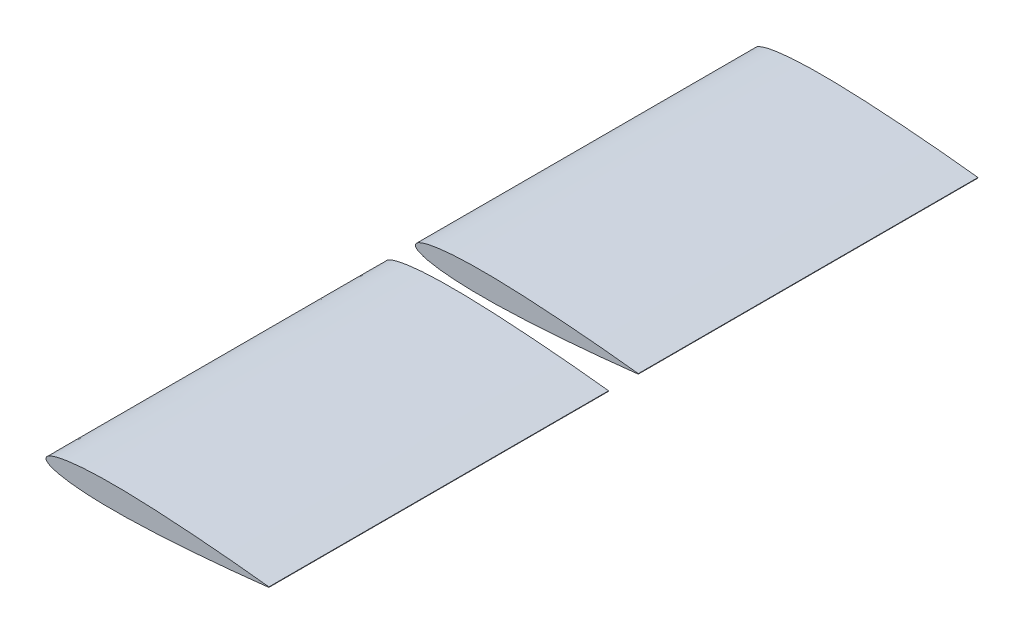
from build123d import *


with BuildPart() as part:
    # Sketch 1 → По сечениям4 section 0
    with BuildSketch(Plane.XY.offset(14)):
        with BuildLine():
            Line((210, 0.2205), (210, -0.2205))
            add(Edge.make_bspline(
                [(0, 0), (0.034067158, -0.292420603), (0.105664858, -0.906990272), (0.654982145, -1.762850878), (1.477827244, -2.567627053), (2.606267905, -3.33690789), (4.023091511, -4.075617294), (5.729219654, -4.784368811), (7.717704809, -5.461720006), (9.98279734, -6.105524733), (12.517370375, -6.713573353), (15.314137556, -7.283443053), (18.365421313, -7.812822801), (21.663304874, -8.299509245), (25.1996562, -8.741465325), (28.966118871, -9.136828938), (32.954113391, -9.484099728), (37.154859686, -9.781897518), (41.559328957, -10.029322752), (46.158276606, -10.225747383), (50.942192731, -10.37091927), (55.901307934, -10.464829704), (61.025559499, -10.508057783), (66.304593914, -10.501238629), (71.727718495, -10.445589818), (77.283891512, -10.342483403), (82.961677867, -10.193594784), (88.749245035, -10.000889903), (94.634276627, -9.76650495), (100.603972997, -9.49274666), (106.644960348, -9.182071299), (112.74327925, -8.837080271), (118.884264816, -8.460372529), (125.052501733, -8.054703608), (131.231690824, -7.622832713), (137.404553341, -7.167478469), (143.552678434, -6.69153668), (149.656348433, -6.197904303), (155.694280367, -5.68953216), (161.643397975, -5.169597978), (169.323110232, -4.474488912), (176.790491196, -3.765014701), (184.000325759, -3.047702994), (189.058977114, -2.529705217), (193.816398006, -2.02910314), (198.210146873, -1.554729941), (202.157323921, -1.118317034), (205.534938991, -0.736774478), (208.088501201, -0.443419152), (209.496053987, -0.279270227), (210, -0.2205)],
                knots=[0, 0, 0, 0, 0.004099011, 0.008614742, 0.013934855, 0.020277775, 0.027752981, 0.036410215, 0.046266433, 0.057320238, 0.069558946, 0.082962861, 0.097507218, 0.113164082, 0.12990269, 0.147690304, 0.166492185, 0.186271967, 0.206991861, 0.228612215, 0.251092165, 0.274388983, 0.298458209, 0.323253842, 0.348727971, 0.374830387, 0.40150919, 0.428710016, 0.456376154, 0.484448083, 0.512863887, 0.541558094, 0.570462313, 0.599504248, 0.628607349, 0.657690446, 0.686667237, 0.715444849, 0.743923546, 0.77199483, 0.799540253, 0.852512115, 0.877624446, 0.901571134, 0.924121062, 0.944988816, 0.963803939, 0.980044339, 0.992855276, 1, 1, 1, 1], degree=3))
            add(Edge.make_bspline(
                [(210, 0.2205), (209.496053987, 0.279270227), (208.088501201, 0.443419152), (205.534938991, 0.736774478), (202.157323921, 1.118317034), (198.210146873, 1.554729941), (193.816398006, 2.02910314), (189.058977114, 2.529705217), (184.000325759, 3.047702994), (176.790491196, 3.765014701), (169.323110232, 4.474488912), (161.643397975, 5.169597978), (155.694280367, 5.68953216), (149.656348433, 6.197904303), (143.552678434, 6.69153668), (137.404553341, 7.167478469), (131.231690824, 7.622832713), (125.052501733, 8.054703608), (118.884264816, 8.460372529), (112.74327925, 8.837080271), (106.644960348, 9.182071299), (100.603972997, 9.49274666), (94.634276627, 9.76650495), (88.749245035, 10.000889903), (82.961677867, 10.193594784), (77.283891512, 10.342483403), (71.727718495, 10.445589818), (66.304593914, 10.501238629), (61.025559499, 10.508057783), (55.901307934, 10.464829704), (50.942192731, 10.37091927), (46.158276606, 10.225747383), (41.559328957, 10.029322752), (37.154859686, 9.781897518), (32.954113391, 9.484099728), (28.966118871, 9.136828938), (25.1996562, 8.741465325), (21.663304874, 8.299509245), (18.365421313, 7.812822801), (15.314137556, 7.283443053), (12.517370375, 6.713573353), (9.98279734, 6.105524733), (7.717704809, 5.461720006), (5.729219654, 4.784368811), (4.023091511, 4.075617294), (2.606267905, 3.33690789), (1.477827244, 2.567627053), (0.654982145, 1.762850878), (0.105664858, 0.906990272), (0.034067158, 0.292420603), (0, 0)],
                knots=[0, 0, 0, 0, 0.007144724, 0.019955661, 0.036196061, 0.055011184, 0.075878938, 0.098428866, 0.122375554, 0.147487885, 0.200459747, 0.22800517, 0.256076454, 0.284555151, 0.313332763, 0.342309554, 0.371392651, 0.400495752, 0.429537687, 0.458441906, 0.487136113, 0.515551917, 0.543623846, 0.571289984, 0.59849081, 0.625169613, 0.651272029, 0.676746158, 0.701541791, 0.725611017, 0.748907835, 0.771387785, 0.793008139, 0.813728033, 0.833507815, 0.852309696, 0.87009731, 0.886835918, 0.902492782, 0.917037139, 0.930441054, 0.942679762, 0.953733567, 0.963589785, 0.972247019, 0.979722225, 0.986065145, 0.991385258, 0.995900989, 1, 1, 1, 1], degree=3))
        make_face()
    # Sketch 2 → По сечениям4 section 1
    with BuildSketch(Plane.XY.offset(170)):
        with BuildLine():
            Line((210, 0.2205), (210, -0.2205))
            add(Edge.make_bspline(
                [(0, 0), (0.034067158, -0.292420603), (0.105664858, -0.906990272), (0.654982145, -1.762850878), (1.477827244, -2.567627053), (2.606267905, -3.33690789), (4.023091511, -4.075617294), (5.729219654, -4.784368811), (7.717704809, -5.461720006), (9.98279734, -6.105524733), (12.517370375, -6.713573353), (15.314137556, -7.283443053), (18.365421313, -7.812822801), (21.663304874, -8.299509245), (25.1996562, -8.741465325), (28.966118871, -9.136828938), (32.954113391, -9.484099728), (37.154859686, -9.781897518), (41.559328957, -10.029322752), (46.158276606, -10.225747383), (50.942192731, -10.37091927), (55.901307934, -10.464829704), (61.025559499, -10.508057783), (66.304593914, -10.501238629), (71.727718495, -10.445589818), (77.283891512, -10.342483403), (82.961677867, -10.193594784), (88.749245035, -10.000889903), (94.634276627, -9.76650495), (100.603972997, -9.49274666), (106.644960348, -9.182071299), (112.74327925, -8.837080271), (118.884264816, -8.460372529), (125.052501733, -8.054703608), (131.231690824, -7.622832713), (137.404553341, -7.167478469), (143.552678434, -6.69153668), (149.656348433, -6.197904303), (155.694280367, -5.68953216), (161.643397975, -5.169597978), (169.323110232, -4.474488912), (176.790491196, -3.765014701), (184.000325759, -3.047702994), (189.058977114, -2.529705217), (193.816398006, -2.02910314), (198.210146873, -1.554729941), (202.157323921, -1.118317034), (205.534938991, -0.736774478), (208.088501201, -0.443419152), (209.496053987, -0.279270227), (210, -0.2205)],
                knots=[0, 0, 0, 0, 0.004099011, 0.008614742, 0.013934855, 0.020277775, 0.027752981, 0.036410215, 0.046266433, 0.057320238, 0.069558946, 0.082962861, 0.097507218, 0.113164082, 0.12990269, 0.147690304, 0.166492185, 0.186271967, 0.206991861, 0.228612215, 0.251092165, 0.274388983, 0.298458209, 0.323253842, 0.348727971, 0.374830387, 0.40150919, 0.428710016, 0.456376154, 0.484448083, 0.512863887, 0.541558094, 0.570462313, 0.599504248, 0.628607349, 0.657690446, 0.686667237, 0.715444849, 0.743923546, 0.77199483, 0.799540253, 0.852512115, 0.877624446, 0.901571134, 0.924121062, 0.944988816, 0.963803939, 0.980044339, 0.992855276, 1, 1, 1, 1], degree=3))
            add(Edge.make_bspline(
                [(210, 0.2205), (209.496053987, 0.279270227), (208.088501201, 0.443419152), (205.534938991, 0.736774478), (202.157323921, 1.118317034), (198.210146873, 1.554729941), (193.816398006, 2.02910314), (189.058977114, 2.529705217), (184.000325759, 3.047702994), (176.790491196, 3.765014701), (169.323110232, 4.474488912), (161.643397975, 5.169597978), (155.694280367, 5.68953216), (149.656348433, 6.197904303), (143.552678434, 6.69153668), (137.404553341, 7.167478469), (131.231690824, 7.622832713), (125.052501733, 8.054703608), (118.884264816, 8.460372529), (112.74327925, 8.837080271), (106.644960348, 9.182071299), (100.603972997, 9.49274666), (94.634276627, 9.76650495), (88.749245035, 10.000889903), (82.961677867, 10.193594784), (77.283891512, 10.342483403), (71.727718495, 10.445589818), (66.304593914, 10.501238629), (61.025559499, 10.508057783), (55.901307934, 10.464829704), (50.942192731, 10.37091927), (46.158276606, 10.225747383), (41.559328957, 10.029322752), (37.154859686, 9.781897518), (32.954113391, 9.484099728), (28.966118871, 9.136828938), (25.1996562, 8.741465325), (21.663304874, 8.299509245), (18.365421313, 7.812822801), (15.314137556, 7.283443053), (12.517370375, 6.713573353), (9.98279734, 6.105524733), (7.717704809, 5.461720006), (5.729219654, 4.784368811), (4.023091511, 4.075617294), (2.606267905, 3.33690789), (1.477827244, 2.567627053), (0.654982145, 1.762850878), (0.105664858, 0.906990272), (0.034067158, 0.292420603), (0, 0)],
                knots=[0, 0, 0, 0, 0.007144724, 0.019955661, 0.036196061, 0.055011184, 0.075878938, 0.098428866, 0.122375554, 0.147487885, 0.200459747, 0.22800517, 0.256076454, 0.284555151, 0.313332763, 0.342309554, 0.371392651, 0.400495752, 0.429537687, 0.458441906, 0.487136113, 0.515551917, 0.543623846, 0.571289984, 0.59849081, 0.625169613, 0.651272029, 0.676746158, 0.701541791, 0.725611017, 0.748907835, 0.771387785, 0.793008139, 0.813728033, 0.833507815, 0.852309696, 0.87009731, 0.886835918, 0.902492782, 0.917037139, 0.930441054, 0.942679762, 0.953733567, 0.963589785, 0.972247019, 0.979722225, 0.986065145, 0.991385258, 0.995900989, 1, 1, 1, 1], degree=3))
        make_face()
    # Sketch 3 → По сечениям4 section 2
    with BuildSketch(Plane.XY.offset(334)):
        with BuildLine():
            Line((210, 0.2205), (210, -0.2205))
            add(Edge.make_bspline(
                [(0, 0), (0.034067158, -0.292420603), (0.105664858, -0.906990272), (0.654982145, -1.762850878), (1.477827244, -2.567627053), (2.606267905, -3.33690789), (4.023091511, -4.075617294), (5.729219654, -4.784368811), (7.717704809, -5.461720006), (9.98279734, -6.105524733), (12.517370375, -6.713573353), (15.314137556, -7.283443053), (18.365421313, -7.812822801), (21.663304874, -8.299509245), (25.1996562, -8.741465325), (28.966118871, -9.136828938), (32.954113391, -9.484099728), (37.154859686, -9.781897518), (41.559328957, -10.029322752), (46.158276606, -10.225747383), (50.942192731, -10.37091927), (55.901307934, -10.464829704), (61.025559499, -10.508057783), (66.304593914, -10.501238629), (71.727718495, -10.445589818), (77.283891512, -10.342483403), (82.961677867, -10.193594784), (88.749245035, -10.000889903), (94.634276627, -9.76650495), (100.603972997, -9.49274666), (106.644960348, -9.182071299), (112.74327925, -8.837080271), (118.884264816, -8.460372529), (125.052501733, -8.054703608), (131.231690824, -7.622832713), (137.404553341, -7.167478469), (143.552678434, -6.69153668), (149.656348433, -6.197904303), (155.694280367, -5.68953216), (161.643397975, -5.169597978), (169.323110232, -4.474488912), (176.790491196, -3.765014701), (184.000325759, -3.047702994), (189.058977114, -2.529705217), (193.816398006, -2.02910314), (198.210146873, -1.554729941), (202.157323921, -1.118317034), (205.534938991, -0.736774478), (208.088501201, -0.443419152), (209.496053987, -0.279270227), (210, -0.2205)],
                knots=[0, 0, 0, 0, 0.004099011, 0.008614742, 0.013934855, 0.020277775, 0.027752981, 0.036410215, 0.046266433, 0.057320238, 0.069558946, 0.082962861, 0.097507218, 0.113164082, 0.12990269, 0.147690304, 0.166492185, 0.186271967, 0.206991861, 0.228612215, 0.251092165, 0.274388983, 0.298458209, 0.323253842, 0.348727971, 0.374830387, 0.40150919, 0.428710016, 0.456376154, 0.484448083, 0.512863887, 0.541558094, 0.570462313, 0.599504248, 0.628607349, 0.657690446, 0.686667237, 0.715444849, 0.743923546, 0.77199483, 0.799540253, 0.852512115, 0.877624446, 0.901571134, 0.924121062, 0.944988816, 0.963803939, 0.980044339, 0.992855276, 1, 1, 1, 1], degree=3))
            add(Edge.make_bspline(
                [(210, 0.2205), (209.496053987, 0.279270227), (208.088501201, 0.443419152), (205.534938991, 0.736774478), (202.157323921, 1.118317034), (198.210146873, 1.554729941), (193.816398006, 2.02910314), (189.058977114, 2.529705217), (184.000325759, 3.047702994), (176.790491196, 3.765014701), (169.323110232, 4.474488912), (161.643397975, 5.169597978), (155.694280367, 5.68953216), (149.656348433, 6.197904303), (143.552678434, 6.69153668), (137.404553341, 7.167478469), (131.231690824, 7.622832713), (125.052501733, 8.054703608), (118.884264816, 8.460372529), (112.74327925, 8.837080271), (106.644960348, 9.182071299), (100.603972997, 9.49274666), (94.634276627, 9.76650495), (88.749245035, 10.000889903), (82.961677867, 10.193594784), (77.283891512, 10.342483403), (71.727718495, 10.445589818), (66.304593914, 10.501238629), (61.025559499, 10.508057783), (55.901307934, 10.464829704), (50.942192731, 10.37091927), (46.158276606, 10.225747383), (41.559328957, 10.029322752), (37.154859686, 9.781897518), (32.954113391, 9.484099728), (28.966118871, 9.136828938), (25.1996562, 8.741465325), (21.663304874, 8.299509245), (18.365421313, 7.812822801), (15.314137556, 7.283443053), (12.517370375, 6.713573353), (9.98279734, 6.105524733), (7.717704809, 5.461720006), (5.729219654, 4.784368811), (4.023091511, 4.075617294), (2.606267905, 3.33690789), (1.477827244, 2.567627053), (0.654982145, 1.762850878), (0.105664858, 0.906990272), (0.034067158, 0.292420603), (0, 0)],
                knots=[0, 0, 0, 0, 0.007144724, 0.019955661, 0.036196061, 0.055011184, 0.075878938, 0.098428866, 0.122375554, 0.147487885, 0.200459747, 0.22800517, 0.256076454, 0.284555151, 0.313332763, 0.342309554, 0.371392651, 0.400495752, 0.429537687, 0.458441906, 0.487136113, 0.515551917, 0.543623846, 0.571289984, 0.59849081, 0.625169613, 0.651272029, 0.676746158, 0.701541791, 0.725611017, 0.748907835, 0.771387785, 0.793008139, 0.813728033, 0.833507815, 0.852309696, 0.87009731, 0.886835918, 0.902492782, 0.917037139, 0.930441054, 0.942679762, 0.953733567, 0.963589785, 0.972247019, 0.979722225, 0.986065145, 0.991385258, 0.995900989, 1, 1, 1, 1], degree=3))
        make_face()
    loft()


with BuildPart() as body_2:
    # Sketch 1 2 → По сечениям6 section 0
    with BuildSketch(Plane.XY.offset(-14)):
        with BuildLine():
            Line((210, 0.2205), (210, -0.2205))
            add(Edge.make_bspline(
                [(0, 0), (0.034067158, -0.292420603), (0.105664858, -0.906990272), (0.654982145, -1.762850878), (1.477827244, -2.567627053), (2.606267905, -3.33690789), (4.023091511, -4.075617294), (5.729219654, -4.784368811), (7.717704809, -5.461720006), (9.98279734, -6.105524733), (12.517370375, -6.713573353), (15.314137556, -7.283443053), (18.365421313, -7.812822801), (21.663304874, -8.299509245), (25.1996562, -8.741465325), (28.966118871, -9.136828938), (32.954113391, -9.484099728), (37.154859686, -9.781897518), (41.559328957, -10.029322752), (46.158276606, -10.225747383), (50.942192731, -10.37091927), (55.901307934, -10.464829704), (61.025559499, -10.508057783), (66.304593914, -10.501238629), (71.727718495, -10.445589818), (77.283891512, -10.342483403), (82.961677867, -10.193594784), (88.749245035, -10.000889903), (94.634276627, -9.76650495), (100.603972997, -9.49274666), (106.644960348, -9.182071299), (112.74327925, -8.837080271), (118.884264816, -8.460372529), (125.052501733, -8.054703608), (131.231690824, -7.622832713), (137.404553341, -7.167478469), (143.552678434, -6.69153668), (149.656348433, -6.197904303), (155.694280367, -5.68953216), (161.643397975, -5.169597978), (169.323110232, -4.474488912), (176.790491196, -3.765014701), (184.000325759, -3.047702994), (189.058977114, -2.529705217), (193.816398006, -2.02910314), (198.210146873, -1.554729941), (202.157323921, -1.118317034), (205.534938991, -0.736774478), (208.088501201, -0.443419152), (209.496053987, -0.279270227), (210, -0.2205)],
                knots=[0, 0, 0, 0, 0.004099011, 0.008614742, 0.013934855, 0.020277775, 0.027752981, 0.036410215, 0.046266433, 0.057320238, 0.069558946, 0.082962861, 0.097507218, 0.113164082, 0.12990269, 0.147690304, 0.166492185, 0.186271967, 0.206991861, 0.228612215, 0.251092165, 0.274388983, 0.298458209, 0.323253842, 0.348727971, 0.374830387, 0.40150919, 0.428710016, 0.456376154, 0.484448083, 0.512863887, 0.541558094, 0.570462313, 0.599504248, 0.628607349, 0.657690446, 0.686667237, 0.715444849, 0.743923546, 0.77199483, 0.799540253, 0.852512115, 0.877624446, 0.901571134, 0.924121062, 0.944988816, 0.963803939, 0.980044339, 0.992855276, 1, 1, 1, 1], degree=3))
            add(Edge.make_bspline(
                [(210, 0.2205), (209.496053987, 0.279270227), (208.088501201, 0.443419152), (205.534938991, 0.736774478), (202.157323921, 1.118317034), (198.210146873, 1.554729941), (193.816398006, 2.02910314), (189.058977114, 2.529705217), (184.000325759, 3.047702994), (176.790491196, 3.765014701), (169.323110232, 4.474488912), (161.643397975, 5.169597978), (155.694280367, 5.68953216), (149.656348433, 6.197904303), (143.552678434, 6.69153668), (137.404553341, 7.167478469), (131.231690824, 7.622832713), (125.052501733, 8.054703608), (118.884264816, 8.460372529), (112.74327925, 8.837080271), (106.644960348, 9.182071299), (100.603972997, 9.49274666), (94.634276627, 9.76650495), (88.749245035, 10.000889903), (82.961677867, 10.193594784), (77.283891512, 10.342483403), (71.727718495, 10.445589818), (66.304593914, 10.501238629), (61.025559499, 10.508057783), (55.901307934, 10.464829704), (50.942192731, 10.37091927), (46.158276606, 10.225747383), (41.559328957, 10.029322752), (37.154859686, 9.781897518), (32.954113391, 9.484099728), (28.966118871, 9.136828938), (25.1996562, 8.741465325), (21.663304874, 8.299509245), (18.365421313, 7.812822801), (15.314137556, 7.283443053), (12.517370375, 6.713573353), (9.98279734, 6.105524733), (7.717704809, 5.461720006), (5.729219654, 4.784368811), (4.023091511, 4.075617294), (2.606267905, 3.33690789), (1.477827244, 2.567627053), (0.654982145, 1.762850878), (0.105664858, 0.906990272), (0.034067158, 0.292420603), (0, 0)],
                knots=[0, 0, 0, 0, 0.007144724, 0.019955661, 0.036196061, 0.055011184, 0.075878938, 0.098428866, 0.122375554, 0.147487885, 0.200459747, 0.22800517, 0.256076454, 0.284555151, 0.313332763, 0.342309554, 0.371392651, 0.400495752, 0.429537687, 0.458441906, 0.487136113, 0.515551917, 0.543623846, 0.571289984, 0.59849081, 0.625169613, 0.651272029, 0.676746158, 0.701541791, 0.725611017, 0.748907835, 0.771387785, 0.793008139, 0.813728033, 0.833507815, 0.852309696, 0.87009731, 0.886835918, 0.902492782, 0.917037139, 0.930441054, 0.942679762, 0.953733567, 0.963589785, 0.972247019, 0.979722225, 0.986065145, 0.991385258, 0.995900989, 1, 1, 1, 1], degree=3))
        make_face()
    # Sketch 2 2 → По сечениям6 section 1
    with BuildSketch(Plane.XY.offset(-170)):
        with BuildLine():
            Line((210, 0.2205), (210, -0.2205))
            add(Edge.make_bspline(
                [(0, 0), (0.034067158, -0.292420603), (0.105664858, -0.906990272), (0.654982145, -1.762850878), (1.477827244, -2.567627053), (2.606267905, -3.33690789), (4.023091511, -4.075617294), (5.729219654, -4.784368811), (7.717704809, -5.461720006), (9.98279734, -6.105524733), (12.517370375, -6.713573353), (15.314137556, -7.283443053), (18.365421313, -7.812822801), (21.663304874, -8.299509245), (25.1996562, -8.741465325), (28.966118871, -9.136828938), (32.954113391, -9.484099728), (37.154859686, -9.781897518), (41.559328957, -10.029322752), (46.158276606, -10.225747383), (50.942192731, -10.37091927), (55.901307934, -10.464829704), (61.025559499, -10.508057783), (66.304593914, -10.501238629), (71.727718495, -10.445589818), (77.283891512, -10.342483403), (82.961677867, -10.193594784), (88.749245035, -10.000889903), (94.634276627, -9.76650495), (100.603972997, -9.49274666), (106.644960348, -9.182071299), (112.74327925, -8.837080271), (118.884264816, -8.460372529), (125.052501733, -8.054703608), (131.231690824, -7.622832713), (137.404553341, -7.167478469), (143.552678434, -6.69153668), (149.656348433, -6.197904303), (155.694280367, -5.68953216), (161.643397975, -5.169597978), (169.323110232, -4.474488912), (176.790491196, -3.765014701), (184.000325759, -3.047702994), (189.058977114, -2.529705217), (193.816398006, -2.02910314), (198.210146873, -1.554729941), (202.157323921, -1.118317034), (205.534938991, -0.736774478), (208.088501201, -0.443419152), (209.496053987, -0.279270227), (210, -0.2205)],
                knots=[0, 0, 0, 0, 0.004099011, 0.008614742, 0.013934855, 0.020277775, 0.027752981, 0.036410215, 0.046266433, 0.057320238, 0.069558946, 0.082962861, 0.097507218, 0.113164082, 0.12990269, 0.147690304, 0.166492185, 0.186271967, 0.206991861, 0.228612215, 0.251092165, 0.274388983, 0.298458209, 0.323253842, 0.348727971, 0.374830387, 0.40150919, 0.428710016, 0.456376154, 0.484448083, 0.512863887, 0.541558094, 0.570462313, 0.599504248, 0.628607349, 0.657690446, 0.686667237, 0.715444849, 0.743923546, 0.77199483, 0.799540253, 0.852512115, 0.877624446, 0.901571134, 0.924121062, 0.944988816, 0.963803939, 0.980044339, 0.992855276, 1, 1, 1, 1], degree=3))
            add(Edge.make_bspline(
                [(210, 0.2205), (209.496053987, 0.279270227), (208.088501201, 0.443419152), (205.534938991, 0.736774478), (202.157323921, 1.118317034), (198.210146873, 1.554729941), (193.816398006, 2.02910314), (189.058977114, 2.529705217), (184.000325759, 3.047702994), (176.790491196, 3.765014701), (169.323110232, 4.474488912), (161.643397975, 5.169597978), (155.694280367, 5.68953216), (149.656348433, 6.197904303), (143.552678434, 6.69153668), (137.404553341, 7.167478469), (131.231690824, 7.622832713), (125.052501733, 8.054703608), (118.884264816, 8.460372529), (112.74327925, 8.837080271), (106.644960348, 9.182071299), (100.603972997, 9.49274666), (94.634276627, 9.76650495), (88.749245035, 10.000889903), (82.961677867, 10.193594784), (77.283891512, 10.342483403), (71.727718495, 10.445589818), (66.304593914, 10.501238629), (61.025559499, 10.508057783), (55.901307934, 10.464829704), (50.942192731, 10.37091927), (46.158276606, 10.225747383), (41.559328957, 10.029322752), (37.154859686, 9.781897518), (32.954113391, 9.484099728), (28.966118871, 9.136828938), (25.1996562, 8.741465325), (21.663304874, 8.299509245), (18.365421313, 7.812822801), (15.314137556, 7.283443053), (12.517370375, 6.713573353), (9.98279734, 6.105524733), (7.717704809, 5.461720006), (5.729219654, 4.784368811), (4.023091511, 4.075617294), (2.606267905, 3.33690789), (1.477827244, 2.567627053), (0.654982145, 1.762850878), (0.105664858, 0.906990272), (0.034067158, 0.292420603), (0, 0)],
                knots=[0, 0, 0, 0, 0.007144724, 0.019955661, 0.036196061, 0.055011184, 0.075878938, 0.098428866, 0.122375554, 0.147487885, 0.200459747, 0.22800517, 0.256076454, 0.284555151, 0.313332763, 0.342309554, 0.371392651, 0.400495752, 0.429537687, 0.458441906, 0.487136113, 0.515551917, 0.543623846, 0.571289984, 0.59849081, 0.625169613, 0.651272029, 0.676746158, 0.701541791, 0.725611017, 0.748907835, 0.771387785, 0.793008139, 0.813728033, 0.833507815, 0.852309696, 0.87009731, 0.886835918, 0.902492782, 0.917037139, 0.930441054, 0.942679762, 0.953733567, 0.963589785, 0.972247019, 0.979722225, 0.986065145, 0.991385258, 0.995900989, 1, 1, 1, 1], degree=3))
        make_face()
    # Sketch 3 2 → По сечениям6 section 2
    with BuildSketch(Plane.XY.offset(-334)):
        with BuildLine():
            Line((210, 0.2205), (210, -0.2205))
            add(Edge.make_bspline(
                [(0, 0), (0.034067158, -0.292420603), (0.105664858, -0.906990272), (0.654982145, -1.762850878), (1.477827244, -2.567627053), (2.606267905, -3.33690789), (4.023091511, -4.075617294), (5.729219654, -4.784368811), (7.717704809, -5.461720006), (9.98279734, -6.105524733), (12.517370375, -6.713573353), (15.314137556, -7.283443053), (18.365421313, -7.812822801), (21.663304874, -8.299509245), (25.1996562, -8.741465325), (28.966118871, -9.136828938), (32.954113391, -9.484099728), (37.154859686, -9.781897518), (41.559328957, -10.029322752), (46.158276606, -10.225747383), (50.942192731, -10.37091927), (55.901307934, -10.464829704), (61.025559499, -10.508057783), (66.304593914, -10.501238629), (71.727718495, -10.445589818), (77.283891512, -10.342483403), (82.961677867, -10.193594784), (88.749245035, -10.000889903), (94.634276627, -9.76650495), (100.603972997, -9.49274666), (106.644960348, -9.182071299), (112.74327925, -8.837080271), (118.884264816, -8.460372529), (125.052501733, -8.054703608), (131.231690824, -7.622832713), (137.404553341, -7.167478469), (143.552678434, -6.69153668), (149.656348433, -6.197904303), (155.694280367, -5.68953216), (161.643397975, -5.169597978), (169.323110232, -4.474488912), (176.790491196, -3.765014701), (184.000325759, -3.047702994), (189.058977114, -2.529705217), (193.816398006, -2.02910314), (198.210146873, -1.554729941), (202.157323921, -1.118317034), (205.534938991, -0.736774478), (208.088501201, -0.443419152), (209.496053987, -0.279270227), (210, -0.2205)],
                knots=[0, 0, 0, 0, 0.004099011, 0.008614742, 0.013934855, 0.020277775, 0.027752981, 0.036410215, 0.046266433, 0.057320238, 0.069558946, 0.082962861, 0.097507218, 0.113164082, 0.12990269, 0.147690304, 0.166492185, 0.186271967, 0.206991861, 0.228612215, 0.251092165, 0.274388983, 0.298458209, 0.323253842, 0.348727971, 0.374830387, 0.40150919, 0.428710016, 0.456376154, 0.484448083, 0.512863887, 0.541558094, 0.570462313, 0.599504248, 0.628607349, 0.657690446, 0.686667237, 0.715444849, 0.743923546, 0.77199483, 0.799540253, 0.852512115, 0.877624446, 0.901571134, 0.924121062, 0.944988816, 0.963803939, 0.980044339, 0.992855276, 1, 1, 1, 1], degree=3))
            add(Edge.make_bspline(
                [(210, 0.2205), (209.496053987, 0.279270227), (208.088501201, 0.443419152), (205.534938991, 0.736774478), (202.157323921, 1.118317034), (198.210146873, 1.554729941), (193.816398006, 2.02910314), (189.058977114, 2.529705217), (184.000325759, 3.047702994), (176.790491196, 3.765014701), (169.323110232, 4.474488912), (161.643397975, 5.169597978), (155.694280367, 5.68953216), (149.656348433, 6.197904303), (143.552678434, 6.69153668), (137.404553341, 7.167478469), (131.231690824, 7.622832713), (125.052501733, 8.054703608), (118.884264816, 8.460372529), (112.74327925, 8.837080271), (106.644960348, 9.182071299), (100.603972997, 9.49274666), (94.634276627, 9.76650495), (88.749245035, 10.000889903), (82.961677867, 10.193594784), (77.283891512, 10.342483403), (71.727718495, 10.445589818), (66.304593914, 10.501238629), (61.025559499, 10.508057783), (55.901307934, 10.464829704), (50.942192731, 10.37091927), (46.158276606, 10.225747383), (41.559328957, 10.029322752), (37.154859686, 9.781897518), (32.954113391, 9.484099728), (28.966118871, 9.136828938), (25.1996562, 8.741465325), (21.663304874, 8.299509245), (18.365421313, 7.812822801), (15.314137556, 7.283443053), (12.517370375, 6.713573353), (9.98279734, 6.105524733), (7.717704809, 5.461720006), (5.729219654, 4.784368811), (4.023091511, 4.075617294), (2.606267905, 3.33690789), (1.477827244, 2.567627053), (0.654982145, 1.762850878), (0.105664858, 0.906990272), (0.034067158, 0.292420603), (0, 0)],
                knots=[0, 0, 0, 0, 0.007144724, 0.019955661, 0.036196061, 0.055011184, 0.075878938, 0.098428866, 0.122375554, 0.147487885, 0.200459747, 0.22800517, 0.256076454, 0.284555151, 0.313332763, 0.342309554, 0.371392651, 0.400495752, 0.429537687, 0.458441906, 0.487136113, 0.515551917, 0.543623846, 0.571289984, 0.59849081, 0.625169613, 0.651272029, 0.676746158, 0.701541791, 0.725611017, 0.748907835, 0.771387785, 0.793008139, 0.813728033, 0.833507815, 0.852309696, 0.87009731, 0.886835918, 0.902492782, 0.917037139, 0.930441054, 0.942679762, 0.953733567, 0.963589785, 0.972247019, 0.979722225, 0.986065145, 0.991385258, 0.995900989, 1, 1, 1, 1], degree=3))
        make_face()
    loft()


solid = Compound([part.part, body_2.part])
